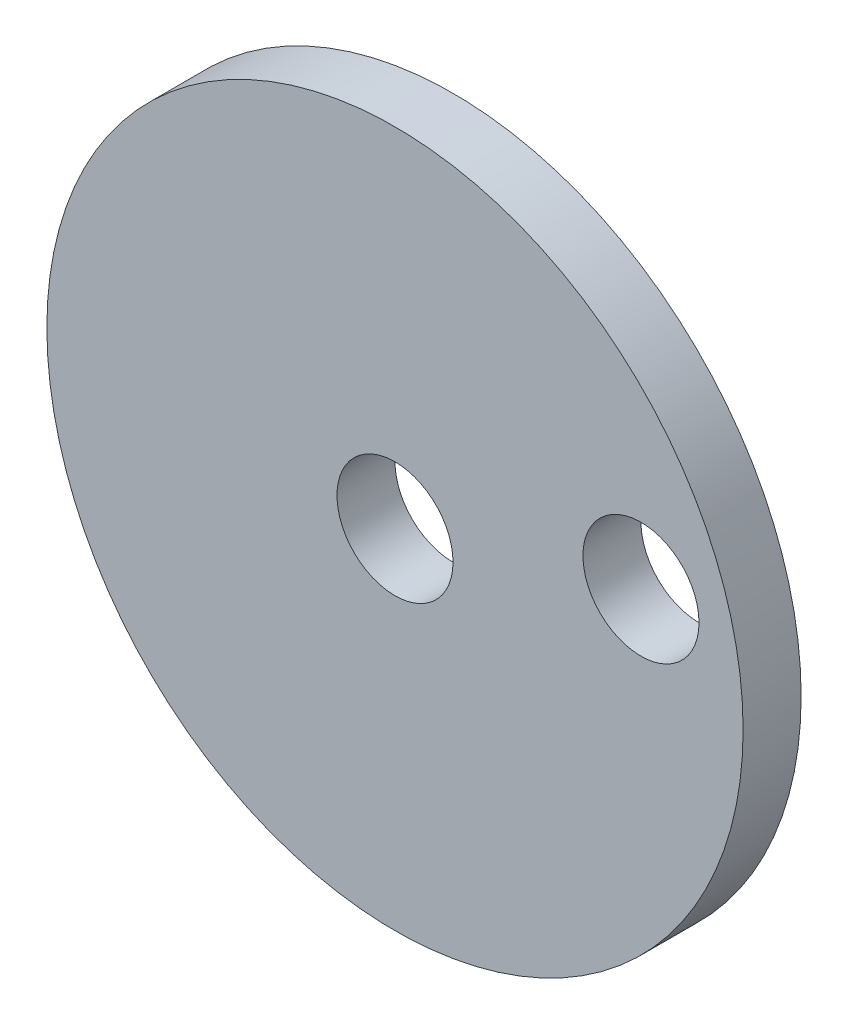
from build123d import *

# Parameters (mm, degrees)
SKETCH1_R           = 38.1
SKETCH1_R_2         = 6.35
BOSS_EXTRUDE1_DEPTH = 6.35


with BuildPart() as part:
    # Sketch1 → Boss-Extrude1 (new body)
    with BuildSketch(Plane.XY):
        Circle(SKETCH1_R)
        Circle(SKETCH1_R_2, mode=Mode.SUBTRACT)
        with Locations((26.921515892, 7.731784841)):
            Circle(SKETCH1_R_2, mode=Mode.SUBTRACT)
    extrude(amount=BOSS_EXTRUDE1_DEPTH)


solid = part.part
